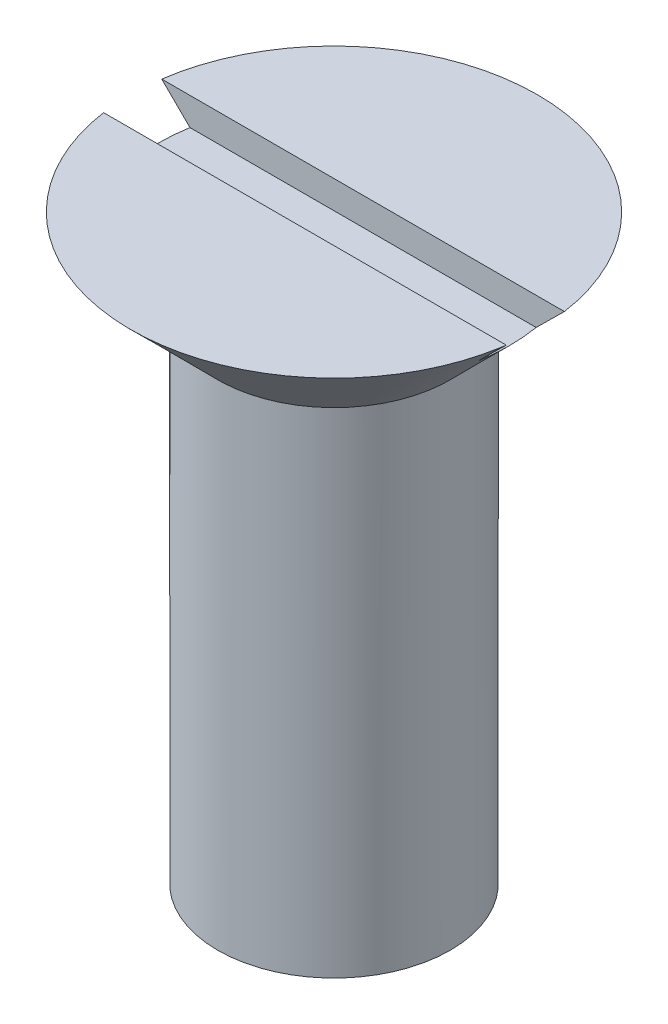
from build123d import *

# Parameters (mm, degrees)
SKETCH2_W          = 16.063598468
SKETCH2_H          = 2
CUT_EXTRUDE1_DEPTH = 0.96


with BuildPart() as part:
    # Sketch1 → Revolve1 (revolve)
    with BuildSketch(Plane.XY, mode=Mode.PRIVATE) as revolve1_sk:
        Polygon((0, 0), (4, 0), (4, 17), (7, 20), (0, 20), align=None)
    revolve(revolve1_sk.sketch.rotate(Axis((0, 0, 0), (0, 1, 0)), 90), axis=Axis((0, 0, 0), (0, 1, 0)))

    # Sketch2 → Cut-Extrude1 (cut)
    with BuildSketch(Plane(origin=(0, 20, 0), x_dir=(1, 0, 0), z_dir=(0, 1, 0))):
        Rectangle(SKETCH2_W, SKETCH2_H)
    extrude(amount=-CUT_EXTRUDE1_DEPTH, mode=Mode.SUBTRACT)


solid = part.part
